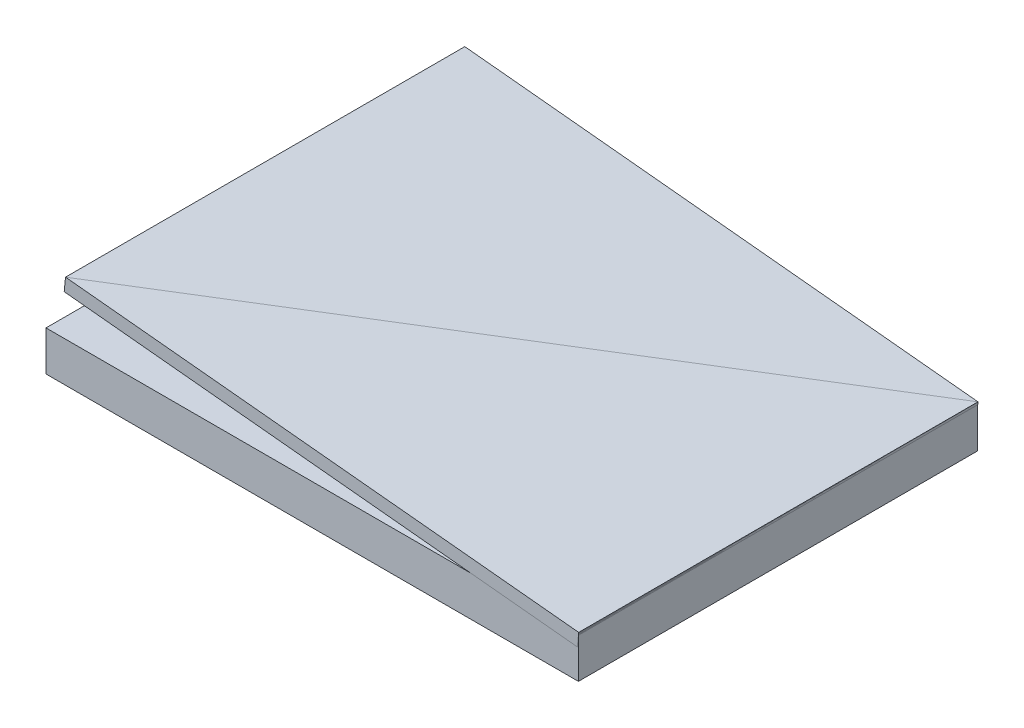
from build123d import *

# Parameters (mm, degrees)
SKETCH1_W                         = 400
SKETCH1_H                         = 30
BOSS_EXTRUDE1_DEPTH               = 150
ESTRUSIONE_ESTRUSIONE5_DEPTH      = 150
ESTRUSIONE_ESTRUSIONE5_DEPTH_BACK = 150
SKETCH3_W                         = 387.448704946
SKETCH3_H                         = 300
BOSS_EXTRUDE2_DEPTH               = 10


with BuildPart() as part:
    # Sketch1 → Boss-Extrude1 (new, symmetric)
    with BuildSketch(Plane.XY):
        with Locations((71.211975439, 518.994449049)):
            Rectangle(SKETCH1_W, SKETCH1_H)
    extrude(amount=BOSS_EXTRUDE1_DEPTH, both=True)


with BuildPart() as body_2:
    # Schizzo9 → Estrusione-Estrusione5 (new, two sides: drawn at the far end of the back side and taken through both)
    with BuildSketch(Plane.XY.offset(-ESTRUSIONE_ESTRUSIONE5_DEPTH_BACK)):
        Polygon((271.211975439, 533.994449049), (-114.334405835, 572.341376579), (-114.136460006, 574.331556834), (271.409921268, 535.984629305), align=None)
    extrude(amount=ESTRUSIONE_ESTRUSIONE5_DEPTH + ESTRUSIONE_ESTRUSIONE5_DEPTH_BACK)


with BuildPart() as body_3:
    # Sketch3 → Boss-Extrude2 (new body)
    with BuildSketch(Plane(origin=(55.446135433, 557.464658807, 0), x_dir=(0.9950901276791769, -0.09897291445359903, 0), z_dir=(0.09897291445359903, 0.9950901276791769, 0))):
        with Locations((23.30501987, 0)):
            Rectangle(SKETCH3_W, SKETCH3_H)
    extrude(amount=-BOSS_EXTRUDE2_DEPTH)


solid = Compound([part.part, body_2.part, body_3.part])
